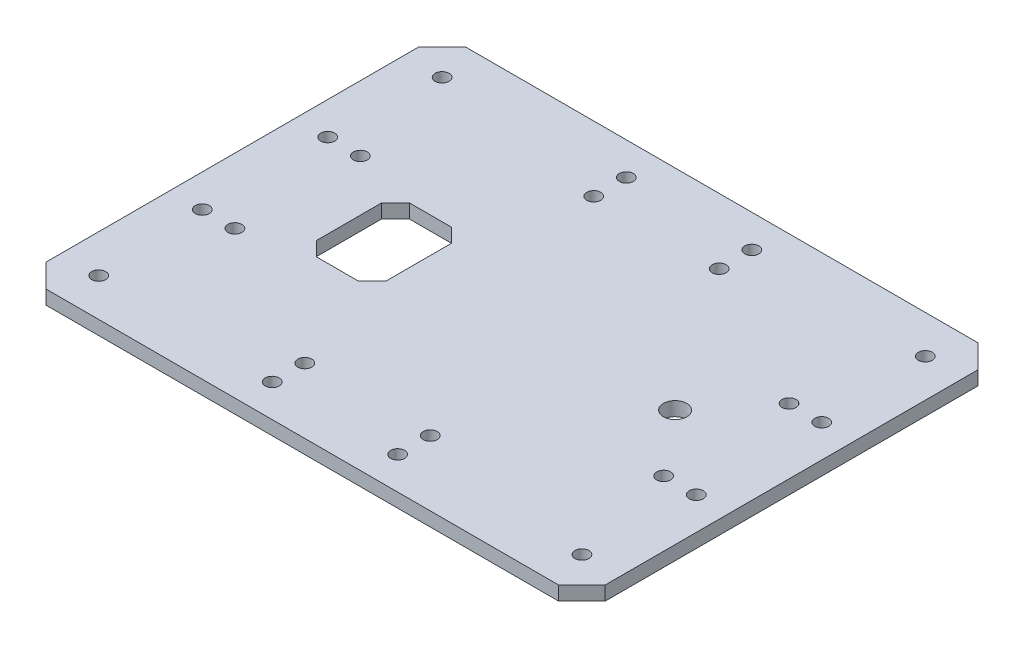
from build123d import *

# Parameters (mm, degrees)
SKETCH1_W                            = 120
SKETCH1_H                            = 90
BOSS_EXTRUDE1_DEPTH                  = 3
CHAMFER1_SIZE                        = 5
F_3_0_3_DIAMETER_HOLE2_D             = 3
MIRROR1_AT_THE_SECOND_PLANE_COPY_1_D = 3
F_3_0_3_DIAMETER_HOLE3_D             = 3
F_5_0_5_DIAMETER_HOLE1_D             = 5
SKETCH11_W                           = 15
SKETCH11_H                           = 20
CUT_EXTRUDE1_DEPTH                   = 76.059976019
CHAMFER2_SIZE                        = 3


with BuildPart() as part:
    # Sketch1 → Boss-Extrude1 (new body)
    with BuildSketch(Plane(origin=(0, 0, 0), x_dir=(1, 0, 0), z_dir=(0, 1, 0))):
        Rectangle(SKETCH1_W, SKETCH1_H)
    extrude(amount=BOSS_EXTRUDE1_DEPTH)

    # Chamfer1
    chamfer1_edges = [part.edges().sort_by_distance(p)[0] for p in [
        (60, 1.5, 45),
        (-60, 1.5, 45),
        (-60, 1.5, -45),
        (60, 1.5, -45),
    ]]
    chamfer(chamfer1_edges, length=CHAMFER1_SIZE)

    # Ø3.0 (3) Diameter Hole2 (through all)
    with Locations(Plane.XZ):
        with Locations((-51.843145751, 36.843145751)):
            f_3_0_3_diameter_hole2 = Hole(F_3_0_3_DIAMETER_HOLE2_D / 2)

    # Mirror1: Ø3.0 (3) Diameter Hole2 across plane
    add(f_3_0_3_diameter_hole2.mirror(Plane.XY), mode=Mode.SUBTRACT)

    # Mirror1 at the second plane: Ø3.0 (3) Diameter Hole2 across plane
    add(f_3_0_3_diameter_hole2.mirror(Plane(origin=(0, 0, 0), x_dir=(0, 0, 1), z_dir=(1, 0, 0))), mode=Mode.SUBTRACT)

    # Mirror1 at the second plane copy 1 (through all)
    with Locations(Plane(origin=(0, 0, 0), x_dir=(-1, 0, 0), z_dir=(0, -1, 0))):
        with Locations((-51.843145751, 36.843145751)):
            Hole(MIRROR1_AT_THE_SECOND_PLANE_COPY_1_D / 2)

    # Ø3.0 (3) Diameter Hole3 (through all)
    with Locations(Plane(origin=(0, 3, 0), x_dir=(1, 0, 0), z_dir=(0, 1, 0))):
        with Locations((46, -13.462985276), (53, -13.462985276), (46, 13.462985276), (53, 13.462985276), (13.462985276, -31), (13.462985276, -38), (-13.462985276, -38), (-13.462985276, -31), (-46, -13.462985276), (-53, -13.462985276), (-46, 13.462985276), (-53, 13.462985276), (13.462985276, 31), (13.462985276, 38), (-13.462985276, 31), (-13.462985276, 38)):
            Hole(F_3_0_3_DIAMETER_HOLE3_D / 2)

    # Ø5.0 (5) Diameter Hole1 (through all)
    with Locations(Plane(origin=(0, 0, 0), x_dir=(-1, 0, 0), z_dir=(0, -1, 0))):
        with Locations((-35, 0)):
            Hole(F_5_0_5_DIAMETER_HOLE1_D / 2)

    # Sketch11 → Cut-Extrude1 (cut, through all)
    with BuildSketch(Plane(origin=(0, 0, 0), x_dir=(-1, 0, 0), z_dir=(0, -1, 0))):
        with Locations((27.5, 0)):
            Rectangle(SKETCH11_W, SKETCH11_H)
    extrude(amount=-CUT_EXTRUDE1_DEPTH, mode=Mode.SUBTRACT)

    # Chamfer2
    chamfer2_edges = [part.edges().sort_by_distance(p)[0] for p in [
        (-35, 1.5, -10),
        (-35, 1.5, 10),
        (-20, 1.5, 10),
        (-20, 1.5, -10),
    ]]
    chamfer(chamfer2_edges, length=CHAMFER2_SIZE)


solid = part.part
